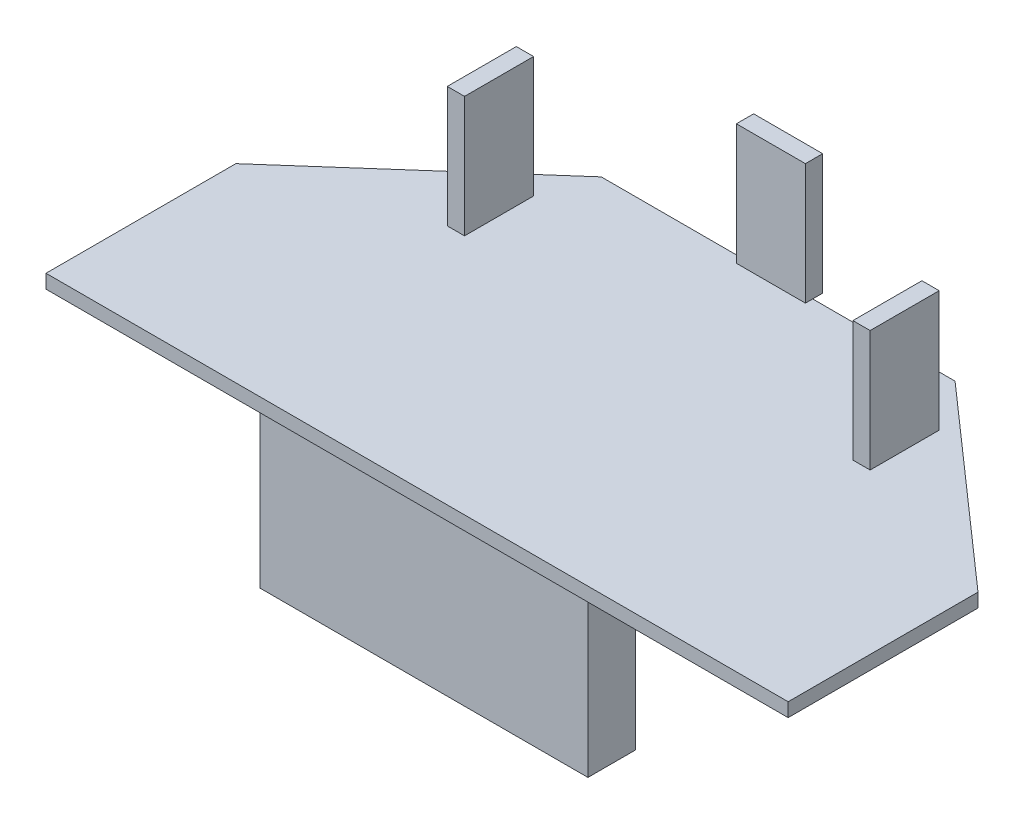
from build123d import *

# Parameters (mm, degrees)
PCB_DEPTH                        = 1.6
SKETCH2_W                        = 38
SKETCH2_H                        = 5.5
J2_HEADER_AND_DUPONT_PLUGS_DEPTH = 20
SKETCH3_W                        = 2
SKETCH3_H                        = 8
TOF_CARRIER_LEFT_DEPTH           = 14
SKETCH4_W                        = 8
SKETCH4_H                        = 2
TOF_CARRIER_AHEAD_DEPTH          = 14
SKETCH5_W                        = 2
SKETCH5_H                        = 8
TOF_CARRIER_RIGHT_DEPTH          = 14


with BuildPart() as part:
    # Sketch1 → PCB (new body)
    with BuildSketch(Plane(origin=(0, -1.6, 0), x_dir=(1, 0, 0), z_dir=(0, 1, 0))):
        Polygon((-43, 0), (43, 0), (43, 22), (20.5, 41.843134833), (-20.5, 41.843134833), (-43, 22), align=None)
    extrude(amount=PCB_DEPTH)

    # Sketch2 → J2 Header And Dupont Plugs (add)
    with BuildSketch(Plane(origin=(0, -20, 0), x_dir=(1, 0, 0), z_dir=(0, 1, 0))):
        with Locations((0, 3.55)):
            Rectangle(SKETCH2_W, SKETCH2_H)
    extrude(amount=J2_HEADER_AND_DUPONT_PLUGS_DEPTH)

    # Sketch3 → ToF Carrier Left (add)
    with BuildSketch(Plane(origin=(0, 0, 0), x_dir=(1, 0, 0), z_dir=(0, 1, 0))):
        with Locations((-23.5, 32)):
            Rectangle(SKETCH3_W, SKETCH3_H)
    extrude(amount=TOF_CARRIER_LEFT_DEPTH)

    # Sketch4 → ToF Carrier Ahead (add)
    with BuildSketch(Plane(origin=(0, 0, 0), x_dir=(1, 0, 0), z_dir=(0, 1, 0))):
        with Locations((0, 42)):
            Rectangle(SKETCH4_W, SKETCH4_H)
    extrude(amount=TOF_CARRIER_AHEAD_DEPTH)

    # Sketch5 → ToF Carrier Right (add)
    with BuildSketch(Plane(origin=(0, 0, 0), x_dir=(1, 0, 0), z_dir=(0, 1, 0))):
        with Locations((23.5, 32)):
            Rectangle(SKETCH5_W, SKETCH5_H)
    extrude(amount=TOF_CARRIER_RIGHT_DEPTH)


solid = part.part
